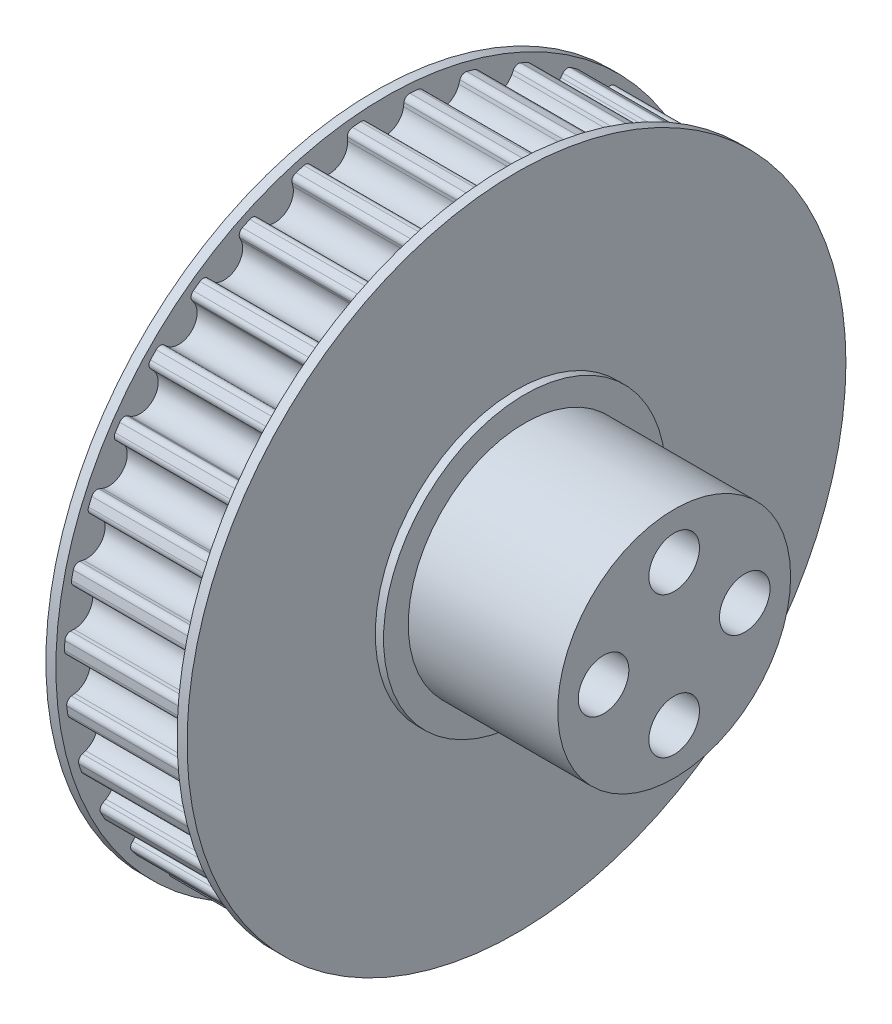
from build123d import *

# Parameters (mm, degrees)
SKETCH_1_W               = 10.3
SKETCH_1_H               = 27.278
CUT_EXTRUDE_2_REACH      = 41.928
PATTERN_CIRCULAR_3_COUNT = 35
SKETCH_7_R               = 28
EXTRUDE_1_DEPTH          = 0.85
SKETCH_8_R               = 12
EXTRUDE_2_DEPTH          = 0.7
SKETCH_9_R               = 9.9
EXTRUDE_3_DEPTH          = 4
SKETCH_10_R              = 2.15
CUT_EXTRUDE_3_DEPTH      = 46.010665403
EXTRUDE_START            = 8.7
SKETCH_11_R              = 9.9
SKETCH_11_R_2            = 2.15
EXTRUDE_4_DEPTH          = 8.7
SKETCH_12_R              = 9.9
SKETCH_12_R_2            = 2.15
EXTRUDE_5_DEPTH          = 6.65


with BuildPart() as part:
    # 草图1 → 旋转1 (revolve)
    with BuildSketch(Plane.XY):
        with Locations((5.15, 13.639)):
            Rectangle(SKETCH_1_W, SKETCH_1_H)
    revolve(axis=Axis((0, 0, 0), (1, 0, 0)))

    # 草图6 → 切除-拉伸2 (cut, up to next)
    with BuildSketch(Plane(origin=(0, 0, 0), x_dir=(0, 0, -1), z_dir=(1, 0, 0)), mode=Mode.PRIVATE) as cut_extrude_2_sk1:
        with BuildLine():
            Line((1.583892871, 26.777178128), (1.548371997, 26.487883824))
            ThreePointArc((1.548371997, 26.487883824), (0, 25.118), (-1.548371997, 26.487883824))
            Line((-1.548371997, 26.487883824), (-1.583892871, 26.777178128))
            ThreePointArc((-1.583892871, 26.777178128), (-1.756322779, 27.090149167), (-2.097218942, 27.197260096))
            ThreePointArc((-2.097218942, 27.197260096), (-2.346390889, 27.17689706), (-2.595365746, 27.154251244))
            Line((-2.595365746, 27.154251244), (-2.792013735, 28.755820587))
            ThreePointArc((-2.792013735, 28.755820587), (0, 28.891046335), (2.792013735, 28.755820587))
            Line((2.792013735, 28.755820587), (2.595365746, 27.154251244))
            ThreePointArc((2.595365746, 27.154251244), (2.346390889, 27.17689706), (2.097218942, 27.197260096))
            ThreePointArc((2.097218942, 27.197260096), (1.756322779, 27.090149167), (1.583892871, 26.777178128))
        make_face()
    cut_extrude_2_tool1 = extrude(cut_extrude_2_sk1.sketch, amount=CUT_EXTRUDE_2_REACH, mode=Mode.PRIVATE) & part.part
    cut_extrude_2 = cut_extrude_2_tool1.solids().sort_by_distance((0, 27.368813, 0))[0]
    add(cut_extrude_2, mode=Mode.SUBTRACT)

    # 阵列(圆周)3: 切除-拉伸2 ×35 about axis
    pattern_circular_3_axis = Axis((-1, 0, 0), (1, 0, 0))
    for i in range(1, PATTERN_CIRCULAR_3_COUNT):
        add(cut_extrude_2.rotate(pattern_circular_3_axis, i * 360 / PATTERN_CIRCULAR_3_COUNT), mode=Mode.SUBTRACT)

    # 草图7 → 凸台-拉伸1 (add)
    with BuildSketch(Plane(origin=(10.3, 0, 0), x_dir=(0, 0, -1), z_dir=(1, 0, 0))):
        Circle(SKETCH_7_R)
    extrude_1 = extrude(amount=EXTRUDE_1_DEPTH)

    # 草图8 → 凸台-拉伸2 (add)
    with BuildSketch(Plane(origin=(11.15, 0, 0), x_dir=(0, 0, -1), z_dir=(1, 0, 0))):
        Circle(SKETCH_8_R)
    extrude_2 = extrude(amount=EXTRUDE_2_DEPTH)

    # 草图9 → 凸台-拉伸3 (add)
    with BuildSketch(Plane(origin=(11.85, 0, 0), x_dir=(0, 0, -1), z_dir=(1, 0, 0))):
        Circle(SKETCH_9_R)
    extrude_3 = extrude(amount=EXTRUDE_3_DEPTH)

    # 镜向1: 凸台-拉伸1, 凸台-拉伸2, 凸台-拉伸3 across plane
    add(extrude_1.mirror(Plane.ZY.offset(-5.15)))
    add(extrude_2.mirror(Plane.ZY.offset(-5.15)))
    add(extrude_3.mirror(Plane.ZY.offset(-5.15)))

    # 草图10 → 切除-拉伸3 (cut, through all)
    with BuildSketch(Plane(origin=(15.85, 0, 0), x_dir=(0, 0, -1), z_dir=(1, 0, 0))):
        with Locations((0, 6)):
            Circle(SKETCH_10_R)
        with Locations((6, 0)):
            Circle(SKETCH_10_R)
        with Locations((0, -6)):
            Circle(SKETCH_10_R)
        with Locations((-6, 0)):
            Circle(SKETCH_10_R)
    extrude(amount=-CUT_EXTRUDE_3_DEPTH, mode=Mode.SUBTRACT)

    # 草图11 → 凸台-拉伸4 (add)
    with BuildSketch(Plane(origin=(15.85, 0, 0), x_dir=(0, 0, -1), z_dir=(1, 0, 0)).offset(EXTRUDE_START)):
        Circle(SKETCH_11_R)
        with Locations((-6, 0)):
            Circle(SKETCH_11_R_2, mode=Mode.SUBTRACT)
        with Locations((0, -6)):
            Circle(SKETCH_11_R_2, mode=Mode.SUBTRACT)
        with Locations((6, 0)):
            Circle(SKETCH_11_R_2, mode=Mode.SUBTRACT)
        with Locations((0, 6)):
            Circle(SKETCH_11_R_2, mode=Mode.SUBTRACT)
    extrude(amount=-EXTRUDE_4_DEPTH)

    # 草图12 → 凸台-拉伸5 (add)
    with BuildSketch(Plane.ZY.offset(5.55)):
        Circle(SKETCH_12_R)
        with Locations((6, 0)):
            Circle(SKETCH_12_R_2, mode=Mode.SUBTRACT)
        with Locations((0, -6)):
            Circle(SKETCH_12_R_2, mode=Mode.SUBTRACT)
        with Locations((0, 6)):
            Circle(SKETCH_12_R_2, mode=Mode.SUBTRACT)
        with Locations((-6, 0)):
            Circle(SKETCH_12_R_2, mode=Mode.SUBTRACT)
    extrude(amount=EXTRUDE_5_DEPTH)


solid = part.part
